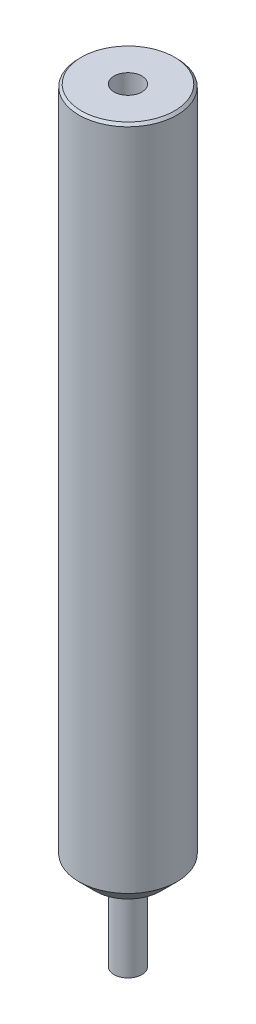
from build123d import *


with BuildPart() as part:
    # Esboço1 → Revolução1 (revolve)
    with BuildSketch(Plane(origin=(0, 0, 0), x_dir=(-1, 0, 0), z_dir=(0, 0, -1)), mode=Mode.PRIVATE) as revolu_o1_sk:
        Polygon((-1.7, 0), (0, 0), (0, 83.6), (-1.7, 83.6), (-1.7, 93.6), (-5.7, 93.6), (-6, 93.3), (-6, 12), (-4, 10), (-1.7, 10), align=None)
    revolve(revolu_o1_sk.sketch.rotate(Axis((0, 0, 0), (0, 1, 0)), 270), axis=Axis((0, 0, 0), (0, 1, 0)))


solid = part.part
